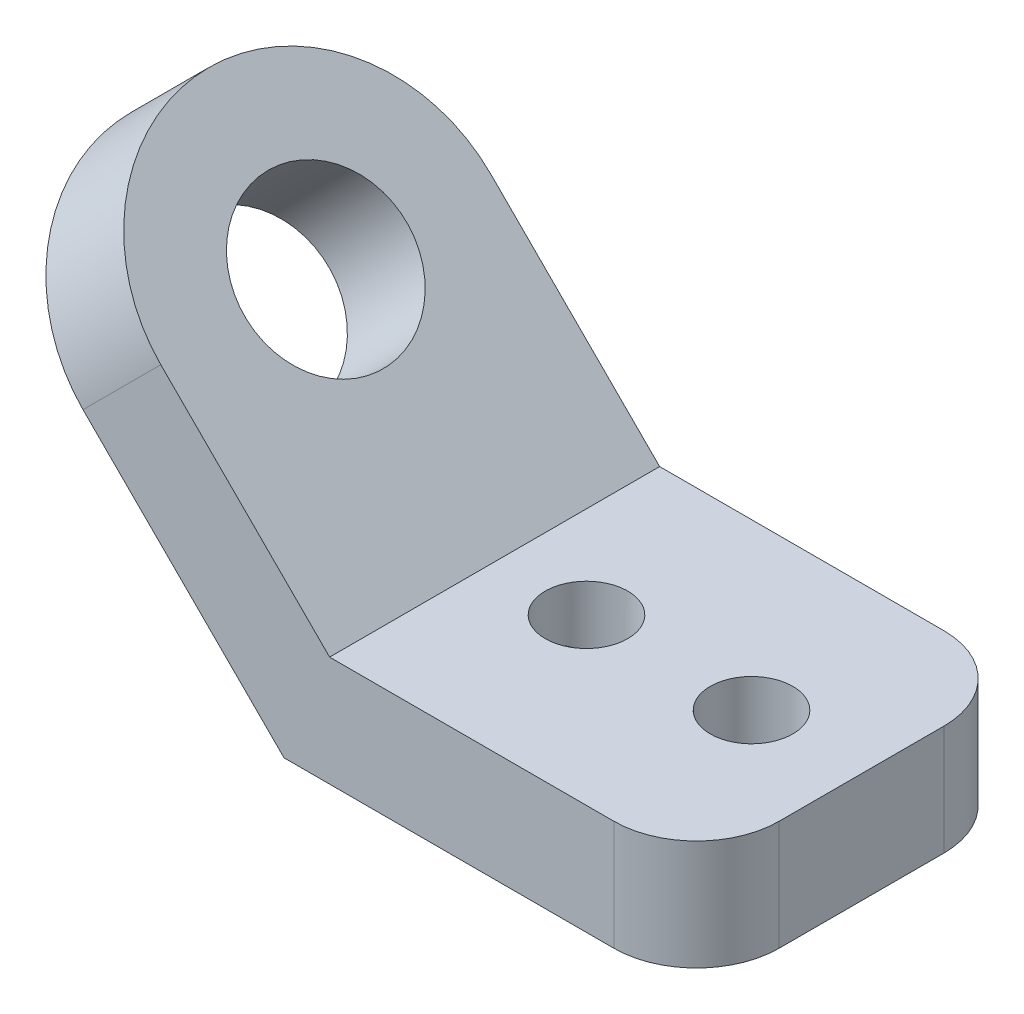
from build123d import *

# Parameters (mm, degrees)
CROQUIS2_R              = 0.75
SALIENTE_EXTRUIR1_DEPTH = 2
CROQUIS6_R              = 1.475
SALIENTE_EXTRUIR3_DEPTH = 2
SALIENTE_EXTRUIR4_REACH = 10.975
CROQUIS8_W              = 6
CROQUIS8_H              = 2


with BuildPart() as part:
    # Croquis2 → Saliente-Extruir1 (new body)
    with BuildSketch(Plane(origin=(0, 0, 0), x_dir=(1, 0, 0), z_dir=(0, 1, 0))):
        with BuildLine():
            Line((-2.585, 3), (2.585, 3))
            ThreePointArc((2.585, 3), (3.645660172, 2.560660172), (4.085, 1.5))
            Line((4.085, 1.5), (4.085, -1.5))
            ThreePointArc((4.085, -1.5), (3.645660172, -2.560660172), (2.585, -3))
            Line((2.585, -3), (-2.585, -3))
            Line((-2.585, -3), (-2.585, 3))
        make_face()
        with Locations(Location((-0.915, 0, 0), (0, 0, 270))):
            Circle(CROQUIS2_R, mode=Mode.SUBTRACT)
        with Locations(Location((2.085, 0, 0), (0, 0, 270))):
            Circle(CROQUIS2_R, mode=Mode.SUBTRACT)
    extrude(amount=SALIENTE_EXTRUIR1_DEPTH)



with BuildPart() as body_2:
    # Croquis6 → Saliente-Extruir3 (new body)
    with BuildSketch(Plane(origin=(-0.2925, -0.2925, 0), x_dir=(0, 0, 1), z_dir=(0.7071067811865438, 0.7071067811865512, 0))):
        with BuildLine():
            Line((-3, -3.242084592), (3, -3.242084592))
            Line((3, -3.242084592), (3, -7.582084592))
            ThreePointArc((3, -7.582084592), (0, -10.582084592), (-3, -7.582084592))
            Line((-3, -7.582084592), (-3, -3.242084592))
        make_face()
        with Locations(Location((0, -7.582084592, 0), (0, 0, 270))):
            Circle(CROQUIS6_R, mode=Mode.SUBTRACT)
    extrude(amount=-SALIENTE_EXTRUIR3_DEPTH)


with BuildPart() as part_1:
    add(part.part)

    add(body_2.part)  # Saliente-Extruir4 merges body 2
    # Saliente-Extruir4: up to this plane
    saliente_extruir4_end = Plane(origin=(2.585, 0, 1.5), z_dir=(0, -1, 0))
    # Croquis8 → Saliente-Extruir4 (add, up to the surface)
    with BuildSketch(Plane(origin=(-2.2925, 2.2925, 0), x_dir=(0, 0, -1), z_dir=(0.7071067811865513, -0.7071067811865438, 0)), mode=Mode.PRIVATE) as saliente_extruir4_sk1:
        with Locations((0, -1.413657467)):
            Rectangle(CROQUIS8_W, CROQUIS8_H)
    saliente_extruir4_tool1 = split(extrude(saliente_extruir4_sk1.sketch, amount=SALIENTE_EXTRUIR4_REACH, mode=Mode.PRIVATE), bisect_by=saliente_extruir4_end, keep=Keep.BOTH, mode=Mode.PRIVATE)
    add(saliente_extruir4_tool1.solids().sort_by_distance((-3.292107, 1.292893, 0))[0])


solid = part_1.part
